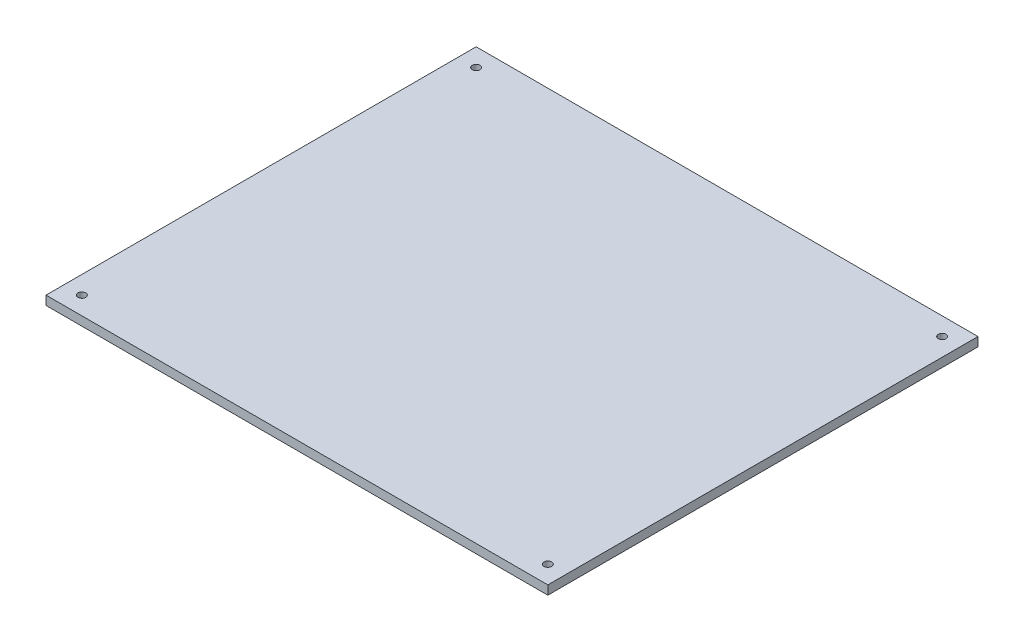
from build123d import *

# Parameters (mm, degrees)
SKETCH1_W           = 177.8
SKETCH1_H           = 152.4
SKETCH1_R           = 1.375
BOSS_EXTRUDE1_DEPTH = 3.175


with BuildPart() as part:
    # Sketch1 → Boss-Extrude1 (new body)
    with BuildSketch(Plane(origin=(0, 0, 0), x_dir=(1, 0, 0), z_dir=(0, 1, 0))):
        with Locations((88.9, 76.2)):
            Rectangle(SKETCH1_W, SKETCH1_H)
        with Locations(Location((6.35, 146.05, 0), (0, 0, 270))):
            Circle(SKETCH1_R, mode=Mode.SUBTRACT)
        with Locations(Location((171.45, 146.05, 0), (0, 0, 270))):
            Circle(SKETCH1_R, mode=Mode.SUBTRACT)
        with Locations(Location((6.35, 6.35, 0), (0, 0, 270))):
            Circle(SKETCH1_R, mode=Mode.SUBTRACT)
        with Locations(Location((171.45, 6.35, 0), (0, 0, 270))):
            Circle(SKETCH1_R, mode=Mode.SUBTRACT)
    extrude(amount=BOSS_EXTRUDE1_DEPTH)


solid = part.part
